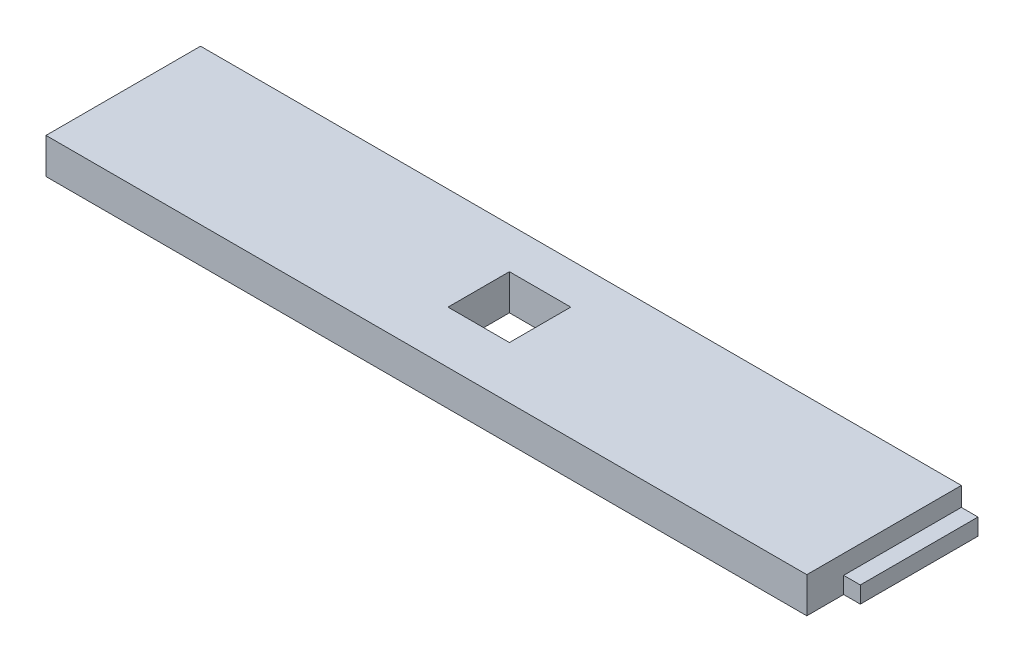
from build123d import *

# Parameters (mm, degrees)
SKETCH2_W           = 640
SKETCH2_H           = 130
SKETCH2_W_2         = 51.63
SKETCH2_H_2         = 51.63
BOSS_EXTRUDE1_DEPTH = 30
SKETCH2_5_W         = 14
SKETCH2_5_H         = 99
BOSS_EXTRUDE2_DEPTH = 14


with BuildPart() as part:
    # Sketch2 → Boss-Extrude1 (new body)
    with BuildSketch(Plane(origin=(0, 0, 0), x_dir=(1, 0, 0), z_dir=(0, 1, 0))):
        Rectangle(SKETCH2_W, SKETCH2_H)
        with Locations((0, 4.815)):
            Rectangle(SKETCH2_W_2, SKETCH2_H_2, mode=Mode.SUBTRACT)
    extrude(amount=BOSS_EXTRUDE1_DEPTH)

    # Sketch2<5> → Boss-Extrude2 (add)
    with BuildSketch(Plane(origin=(0, 0, 0), x_dir=(1, 0, 0), z_dir=(0, 1, 0))):
        with Locations((-327, 15.5)):
            Rectangle(SKETCH2_5_W, SKETCH2_5_H)
        with Locations((327, 15.5)):
            Rectangle(SKETCH2_5_W, SKETCH2_5_H)
    extrude(amount=BOSS_EXTRUDE2_DEPTH)


solid = part.part
